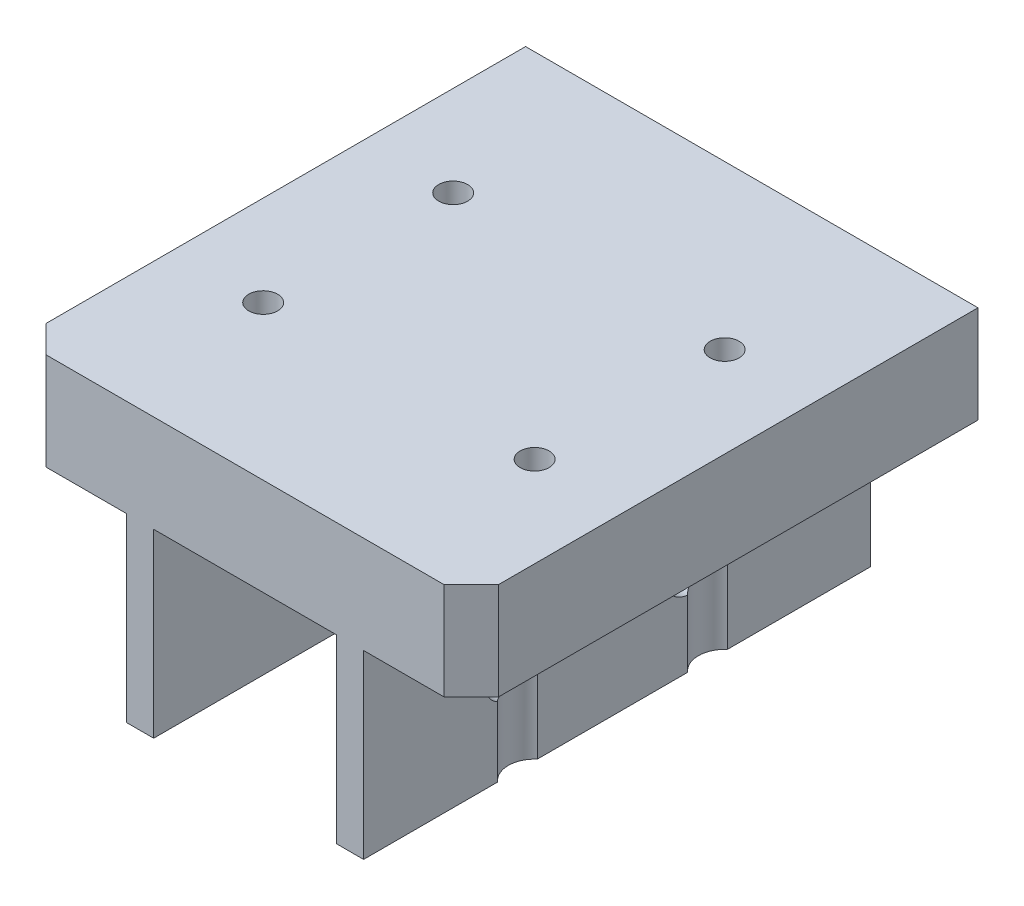
from build123d import *

# Parameters (mm, degrees)
EXTRUDE_1_DEPTH             = 53
HOLE_WIZARD_1_D             = 3
SKETCH_6_R                  = 2.9
CUT_EXTRUDE_1_DEPTH         = 62.919302322
CHAMFER_1_SIZE              = 3
HOLE_WIZARD_2_D             = 5.2
HOLE_WIZARD_M3_1_AT_2_COUNT = 2
HOLE_WIZARD_M3_1_AT_2_PITCH = 30
HOLE_WIZARD_M3_1_AT_3_COUNT = 2
HOLE_WIZARD_M3_1_AT_3_PITCH = 36.619666847
HOLE_WIZARD_M3_1_AT_4_COUNT = 2
HOLE_WIZARD_M3_1_AT_4_PITCH = 21
EXTRUDE_2_DEPTH             = 3


with BuildPart() as part:
    # 草图1 → 凸台-拉伸1 (new body)
    with BuildSketch(Plane.XY):
        Polygon((-13.1, -14.961364275), (-10.1, -14.961364275), (-10.1, 5.038635725), (10.1, 5.038635725), (10.1, -14.961364275), (13.1, -14.961364275), (13.1, 5.038635725), (25, 5.038635725), (25, 15.788635725), (-25, 15.788635725), (-25, 5.038635725), (-13.1, 5.038635725), align=None)
    extrude(amount=EXTRUDE_1_DEPTH)

    # 孔1 (through all)
    with Locations(Plane(origin=(0, 5.038635725, 0), x_dir=(-1, 0, 0), z_dir=(0, -1, 0))):
        with Locations((15, -15), (15, -36), (-15, -15), (-15, -36)):
            Hole(HOLE_WIZARD_1_D / 2)

    # 草图6 → 切除-拉伸1 (cut, through all)
    with BuildSketch(Plane.XZ.offset(-5.038635725)):
        with Locations((15, 36)):
            Circle(SKETCH_6_R)
        with Locations((15, 15)):
            Circle(SKETCH_6_R)
        with Locations((-15, 15)):
            Circle(SKETCH_6_R)
        with Locations((-15, 36)):
            Circle(SKETCH_6_R)
    extrude(amount=CUT_EXTRUDE_1_DEPTH, mode=Mode.SUBTRACT)

    # 倒角1
    chamfer_1_edges = [part.edges().sort_by_distance(p)[0] for p in [
        (-25, 10.413635725, 53),
        (25, 10.413635725, 53),
    ]]
    chamfer(chamfer_1_edges, length=CHAMFER_1_SIZE)

    # 孔2 (through all)
    with Locations(Plane(origin=(13.1, 0, 0), x_dir=(0, 0, -1), z_dir=(1, 0, 0))):
        with Locations((-17, -4.961364275), (-37, -4.961364275)):
            Hole(HOLE_WIZARD_2_D / 2)

    # 草图10 → M3 十字槽沉头木螺钉的锥形沉头孔1 (revolve, cut)
    with BuildSketch(Plane(origin=(15, 5.038635725, 15), x_dir=(0, 0, -1), z_dir=(1, 0, 0))):
        Polygon((0, 0), (0, 10.75), (1.6, 10.75), (1.6, 1.7), (3.3, 0), align=None)
    hole_wizard_m3_1 = revolve(axis=Axis((15, -1.311364275, 15), (0, 1, 0)), mode=Mode.SUBTRACT)

    # M3 十字槽沉头木螺钉的锥形沉头孔1 at 2: M3 十字槽沉头木螺钉的锥形沉头孔1 ×2
    with Locations(*[(-i * HOLE_WIZARD_M3_1_AT_2_PITCH, 0, 0) for i in range(1, HOLE_WIZARD_M3_1_AT_2_COUNT)]):
        add(hole_wizard_m3_1, mode=Mode.SUBTRACT)

    # M3 十字槽沉头木螺钉的锥形沉头孔1 at 3: M3 十字槽沉头木螺钉的锥形沉头孔1 ×2
    with Locations(*[Vector(-0.8192319205190406, 0, 0.5734623443633283) * (i * HOLE_WIZARD_M3_1_AT_3_PITCH) for i in range(1, HOLE_WIZARD_M3_1_AT_3_COUNT)]):
        add(hole_wizard_m3_1, mode=Mode.SUBTRACT)

    # M3 十字槽沉头木螺钉的锥形沉头孔1 at 4: M3 十字槽沉头木螺钉的锥形沉头孔1 ×2
    with Locations(*[(0, 0, i * HOLE_WIZARD_M3_1_AT_4_PITCH) for i in range(1, HOLE_WIZARD_M3_1_AT_4_COUNT)]):
        add(hole_wizard_m3_1, mode=Mode.SUBTRACT)

    # 草图12 → 凸台-拉伸2 (add)
    with BuildSketch(Plane(origin=(0, 0, 0), x_dir=(-1, 0, 0), z_dir=(0, 0, -1))):
        Polygon((-10.1, 5.038635725), (10.1, 5.038635725), (10.1, -14.961364275), (13.1, -14.961364275), (13.1, 5.038635725), (25, 5.038635725), (25, 15.788635725), (-25, 15.788635725), (-25, 5.038635725), (-13.1, 5.038635725), (-13.1, -14.961364275), (-10.1, -14.961364275), align=None)
    extrude(amount=EXTRUDE_2_DEPTH)


solid = part.part
